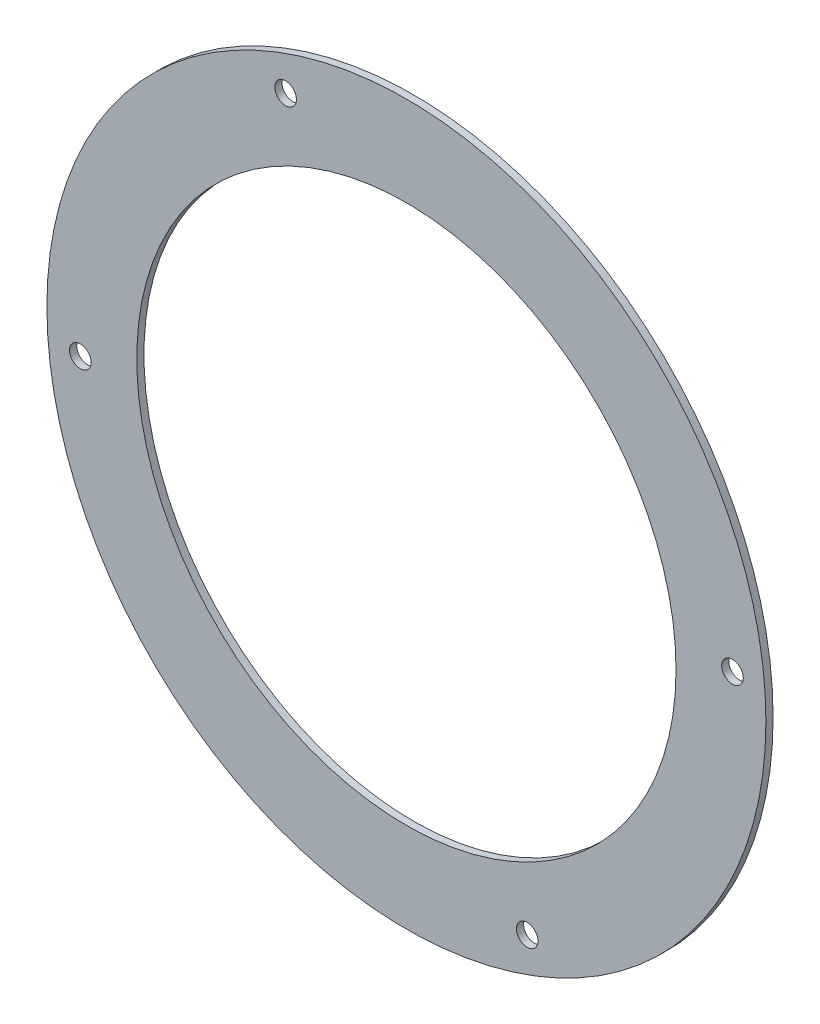
from build123d import *

# Parameters (mm, degrees)
SKETCH_1_R      = 50
SKETCH_1_R_2    = 37.5
SKETCH_1_R_3    = 1.5
EXTRUDE_1_DEPTH = 1


with BuildPart() as part:
    # 草图1 → 凸台-拉伸1 (new body)
    with BuildSketch(Plane.XY):
        with Locations((-144.815895817, -92.623408185)):
            Circle(SKETCH_1_R)
        with Locations((-144.815895817, -92.623408185)):
            Circle(SKETCH_1_R_2, mode=Mode.SUBTRACT)
        with Locations((-190.167161981, -96.299364834)):
            Circle(SKETCH_1_R_3, mode=Mode.SUBTRACT)
        with Locations((-128.01669653, -134.908593573)):
            Circle(SKETCH_1_R_3, mode=Mode.SUBTRACT)
        with Locations(Location((-99.464629653, -88.947451536, 0), (0, 0, 180))):
            Circle(SKETCH_1_R_3, mode=Mode.SUBTRACT)
        with Locations(Location((-161.615095104, -50.338222797, 0), (0, 0, 180))):
            Circle(SKETCH_1_R_3, mode=Mode.SUBTRACT)
    extrude(amount=EXTRUDE_1_DEPTH)


solid = part.part
